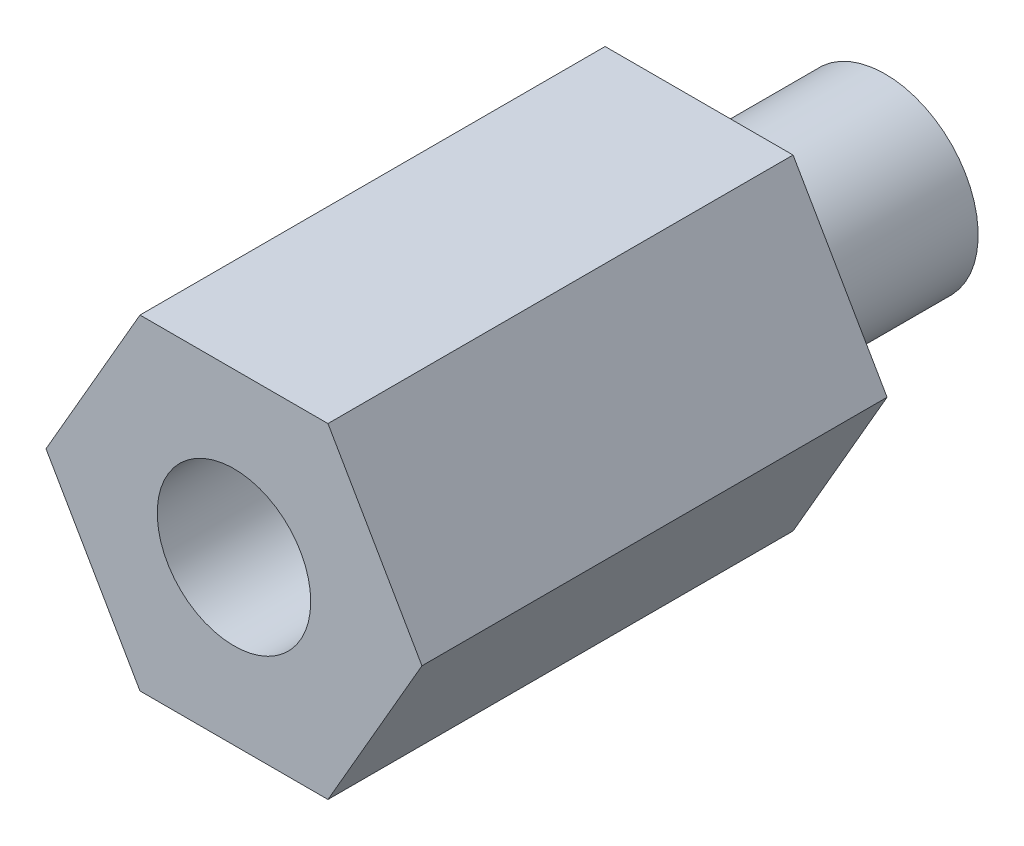
from build123d import *

# Parameters (mm, degrees)
EXTRUDE_1_DEPTH = 10
SKETCH_4_R      = 2
EXTRUDE_2_DEPTH = 4
M4X0_7_1_D      = 3.3
M4X0_7_1_DEPTH  = 8
M4X0_7_1_TIP    = 0.991420021


with BuildPart() as part:
    # 草圖1 → 填料-伸長1 (new body)
    with BuildSketch(Plane.XY):
        Polygon((-2.020725942, 3.5), (-4.041451884, 0), (-2.020725942, -3.5), (2.020725942, -3.5), (4.041451884, 0), (2.020725942, 3.5), align=None)
    extrude(amount=EXTRUDE_1_DEPTH)

    # 草圖4 → 填料-伸長2 (add)
    with BuildSketch(Plane(origin=(0, 0, 0), x_dir=(-1, 0, 0), z_dir=(0, 0, -1))):
        Circle(SKETCH_4_R)
    extrude(amount=EXTRUDE_2_DEPTH)

    # M4x0.7 螺紋孔1
    with Locations(Plane.XY.offset(10)):
        with Locations((0, 0)):
            Hole(M4X0_7_1_D / 2, depth=M4X0_7_1_DEPTH)
            with Locations((0, 0, -(M4X0_7_1_DEPTH + M4X0_7_1_TIP / 2))):  # 118° drill point
                Cone(0, M4X0_7_1_D / 2, M4X0_7_1_TIP, mode=Mode.SUBTRACT)


solid = part.part
